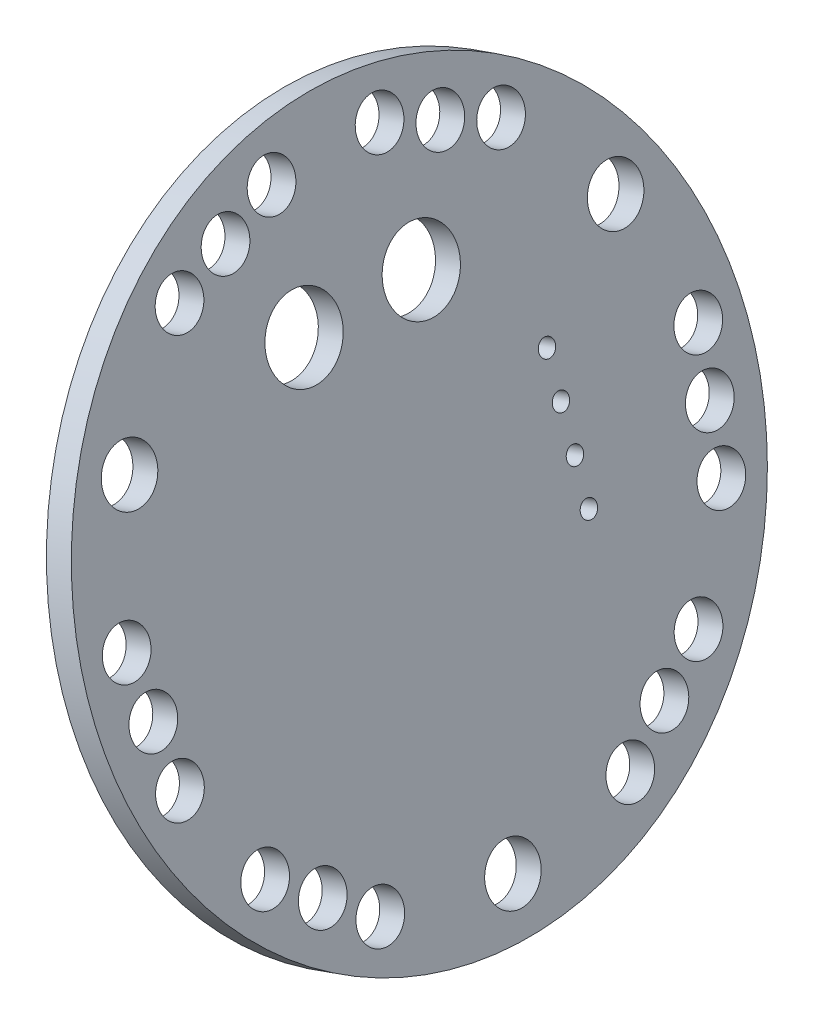
from build123d import *

# Parameters (mm, degrees)
SKETCH1_R           = 20
BOSS_EXTRUDE1_DEPTH = 1.6
SKETCH2_R           = 1.625
CUT_EXTRUDE1_DEPTH  = 30.030785713
SKETCH3_R           = 1.4
CUT_EXTRUDE2_DEPTH  = 30.030785713
CIRPATTERN1_COUNT   = 3
SKETCH4_R           = 0.5
CUT_EXTRUDE3_DEPTH  = 30.030785713
SKETCH5_R           = 2.25
CUT_EXTRUDE4_DEPTH  = 30.030785713


with BuildPart() as part:
    # Sketch1 → Boss-Extrude1 (new body)
    with BuildSketch(Plane(origin=(-6.693944195, -2.366666667, 0), x_dir=(0, 0, -1), z_dir=(0.9428090415820737, 0.3333333333333042, 1.703606547556464e-15))):
        with Locations(Location((0, 0, 0), (0, 0, 90))):
            Circle(SKETCH1_R)
    extrude(amount=BOSS_EXTRUDE1_DEPTH)

    # Sketch2 → Cut-Extrude1 (cut, through all)
    with BuildSketch(Plane(origin=(-5.185449729, -1.833333333, 0), x_dir=(0, 0, -1), z_dir=(0.9428090415820737, 0.3333333333333043, 1.703606547556464e-15))):
        with Locations(Location((0, -17, 0), (0, 0, 90))):
            Circle(SKETCH2_R)
        with Locations(Location((-14.722431864, 8.5, 0), (0, 0, 90))):
            Circle(SKETCH2_R)
        with Locations(Location((14.722431864, 8.5, 0), (0, 0, 90))):
            Circle(SKETCH2_R)
    extrude(amount=-CUT_EXTRUDE1_DEPTH, mode=Mode.SUBTRACT)

    # Sketch3 → Cut-Extrude2 (cut, through all)
    with BuildSketch(Plane(origin=(-5.185449729, -1.833333333, 0), x_dir=(0, 0, -1), z_dir=(0.9428090415820736, 0.3333333333333042, 1.7036065475564638e-15))):
        with Locations(Location((-9.739196714, 14.366560039, 0), (0, 0, 90))):
            Circle(SKETCH3_R)
        with Locations(Location((-3.272039986, 17.045344066, 0), (0, 0, 90))):
            Circle(SKETCH3_R)
        with Locations(Location((-6.50561835, 15.705952053, 0), (0, 0, 90))):
            Circle(SKETCH3_R)
        with Locations(Location((9.739196714, 14.366560039, 0), (0, 0, 90))):
            Circle(SKETCH3_R)
        with Locations(Location((6.50561835, 15.705952053, 0), (0, 0, 90))):
            Circle(SKETCH3_R)
        with Locations(Location((3.272039986, 17.045344066, 0), (0, 0, 90))):
            Circle(SKETCH3_R)
    cut_extrude2 = extrude(amount=-CUT_EXTRUDE2_DEPTH, mode=Mode.SUBTRACT)

    # CirPattern1: Cut-Extrude2 ×3 about axis
    cirpattern1_axis = Axis((0, 0, 0), (0.9428090415820737, 0.3333333333333042, 1.703606547556464e-15))
    for i in range(1, CIRPATTERN1_COUNT):
        add(cut_extrude2.rotate(cirpattern1_axis, i * 360 / CIRPATTERN1_COUNT), mode=Mode.SUBTRACT)

    # Sketch4 → Cut-Extrude3 (cut, through all)
    with BuildSketch(Plane(origin=(-5.185449729, -1.833333333, 0), x_dir=(0, 0, -1), z_dir=(0.9428090415820736, 0.3333333333333042, 1.7036065475564638e-15))):
        with Locations(Location((9, 3.81, 0), (0, 0, 90))):
            Circle(SKETCH4_R)
        with Locations(Location((9, 1.27, 0), (0, 0, 90))):
            Circle(SKETCH4_R)
        with Locations(Location((9, -1.27, 0), (0, 0, 90))):
            Circle(SKETCH4_R)
        with Locations(Location((9, -3.81, 0), (0, 0, 90))):
            Circle(SKETCH4_R)
    extrude(amount=-CUT_EXTRUDE3_DEPTH, mode=Mode.SUBTRACT)

    # Sketch5 → Cut-Extrude4 (cut, through all)
    with BuildSketch(Plane(origin=(-5.185449729, -1.833333333, 0), x_dir=(0, 0, -1), z_dir=(0.9428090415820737, 0.3333333333333043, 1.703606547556464e-15))):
        with Locations(Location((-3.65, 10, 0), (0, 0, 90))):
            Circle(SKETCH5_R)
        with Locations(Location((3.45, 10, 0), (0, 0, 90))):
            Circle(SKETCH5_R)
    extrude(amount=-CUT_EXTRUDE4_DEPTH, mode=Mode.SUBTRACT)


solid = part.part
